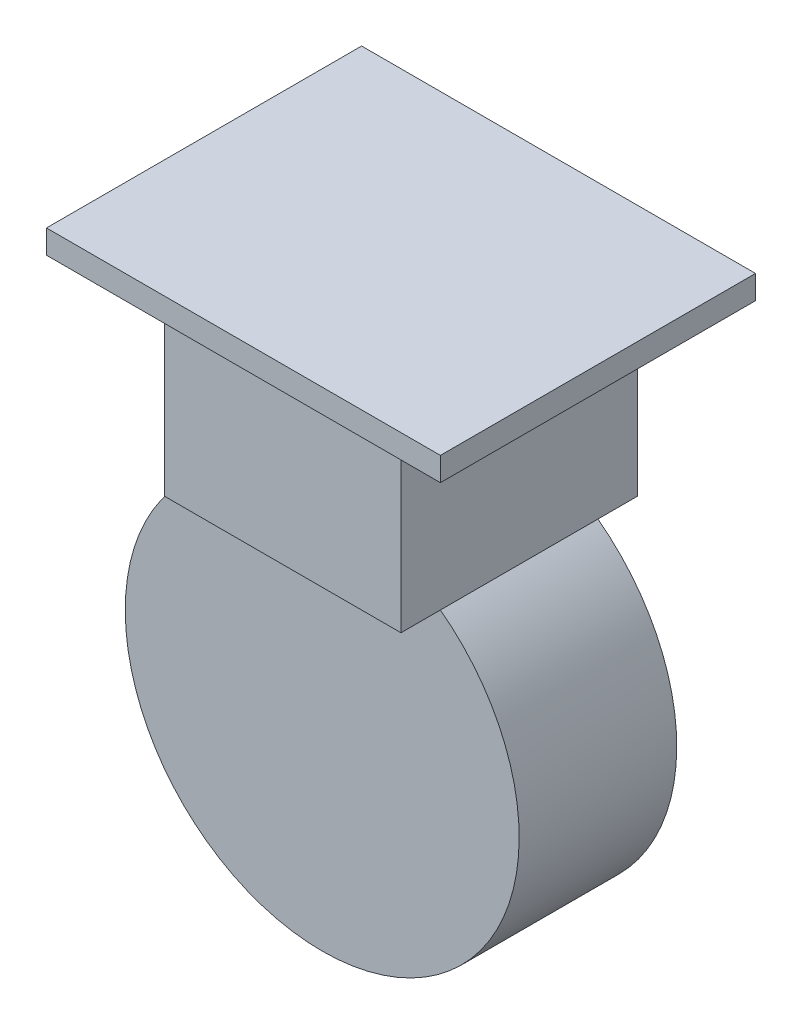
from build123d import *

# Parameters (mm, degrees)
SK_CASTERWHEEL_W = 25
SK_CASTERWHEEL_H = 20
SK_FORK_W        = 30
SK_FORK_H        = 24
FORK_DEPTH       = 15
SK_TOPPLATE_W    = 50
SK_TOPPLATE_H    = 3
TOPPLATE_DEPTH   = 20


with BuildPart() as part:
    # SK_CasterWheel → CasterWheel (revolve)
    with BuildSketch(Plane(origin=(0, 0, 0), x_dir=(1, 0, 0), z_dir=(0, 1, 0)), mode=Mode.PRIVATE) as casterwheel_sk:
        with Locations((12.5, 0)):
            Rectangle(SK_CASTERWHEEL_W, SK_CASTERWHEEL_H)
    revolve(casterwheel_sk.sketch.rotate(Axis((0, 0, -15), (0, 0, 1)), 180), axis=Axis((0, 0, -15), (0, 0, 1)))

    # SK_Fork → Fork (add, symmetric)
    with BuildSketch(Plane.XY):
        with Locations((0, 32)):
            Rectangle(SK_FORK_W, SK_FORK_H)
    extrude(amount=FORK_DEPTH, both=True)

    # SK_TopPlate → TopPlate (add, symmetric)
    with BuildSketch(Plane.XY):
        with Locations((0, 45.5)):
            Rectangle(SK_TOPPLATE_W, SK_TOPPLATE_H)
    extrude(amount=TOPPLATE_DEPTH, both=True)


solid = part.part
